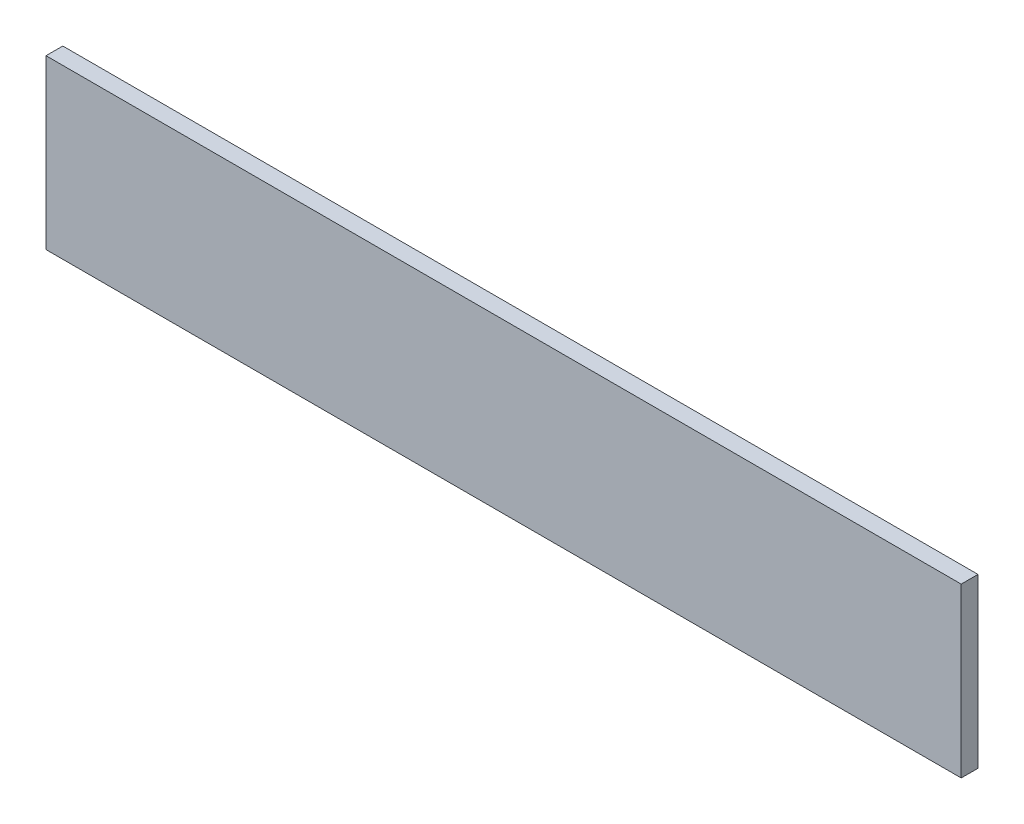
from build123d import *

# Parameters (mm, degrees)
SKETCH_1_W      = 109
SKETCH_1_H      = 20
EXTRUDE_1_DEPTH = 2


with BuildPart() as part:
    # 草图1 → 凸台-拉伸1 (new body)
    with BuildSketch(Plane.XY):
        with Locations((54.5, -10)):
            Rectangle(SKETCH_1_W, SKETCH_1_H)
    extrude(amount=EXTRUDE_1_DEPTH)


solid = part.part
